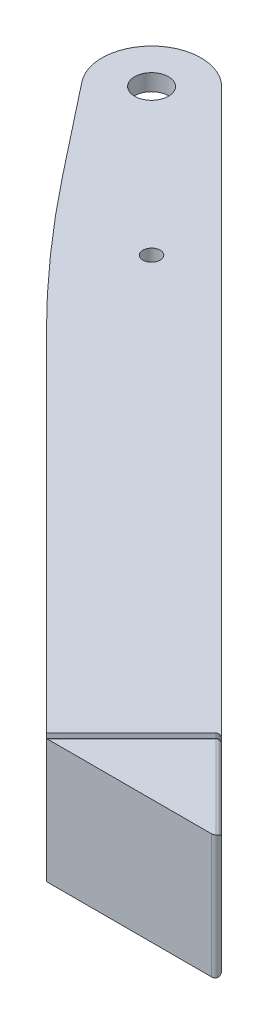
from build123d import *

# Parameters (mm, degrees)
SKETCH_2_R      = 4.1
SKETCH_2_R_2    = 2.1
EXTRUDE_1_DEPTH = 4
FILLET_1_R      = 400
EXTRUDE_4_DEPTH = 30
EXTRUDE_5_REACH = 231.249
SKETCH_8_W      = 30
SKETCH_8_H      = 13
FILLET_5_R      = 1


with BuildPart() as part:
    # 草图2 → 凸台-拉伸1 (new body)
    with BuildSketch(Plane(origin=(0, 0, 0), x_dir=(1, 0, 0), z_dir=(0, 1, 0))):
        with BuildLine():
            Line((136.929210249, -162.385054371), (179.35561712, -162.385054371))
            Line((179.35561712, -162.385054371), (8.485281374, 8.485281374))
            ThreePointArc((8.485281374, 8.485281374), (-7.971171133, 8.969973844), (-9.423568154, -7.429425499))
            Line((-9.423568154, -7.429425499), (22.627416998, -48.083261121))
            Line((22.627416998, -48.083261121), (136.929210249, -162.385054371))
        make_face()
        with Locations(Location((0, 0, 0), (0, 0, 270))):
            Circle(SKETCH_2_R, mode=Mode.SUBTRACT)
        with Locations(Location((35.355339059, -35.355339059, 0), (0, 0, 270))):
            Circle(SKETCH_2_R_2, mode=Mode.SUBTRACT)
    extrude(amount=EXTRUDE_1_DEPTH)

    # 圆角1
    fillet_1_edges = [part.edges().sort_by_distance(p)[0] for p in [
        (22.627416998, 2, 48.083261121),
    ]]
    fillet(fillet_1_edges, radius=FILLET_1_R)

    # 草图6 → 凸台-拉伸4 (add)
    with BuildSketch(Plane(origin=(-12.727922061, 0, 12.727922061), x_dir=(0.7071067811865476, 0, 0.7071067811865475), z_dir=(-0.7071067811865475, 0, 0.7071067811865476))):
        Polygon((191.647146219, 4), (191.647146219, 0), (211.647146219, -13), (211.647146219, 17), align=None)
    extrude(amount=-EXTRUDE_4_DEPTH)

    # 凸台-拉伸5: up to this face of the body (flat: up to its plane)
    extrude_5_end = Plane(part.part.faces().sort_by_distance((158.142413684, 2, 162.385054371))[0])
    # 草图8 → 凸台-拉伸5 (add, up to the picked face)
    with BuildSketch(Plane(origin=(149.65713231, 0, 149.65713231), x_dir=(0.7071067811865475, 0, -0.7071067811865476), z_dir=(0.7071067811865476, 0, 0.7071067811865475)), mode=Mode.PRIVATE) as extrude_5_sk1:
        with Locations((-3, 10.5)):
            Rectangle(SKETCH_8_W, SKETCH_8_H)
    extrude_5_tool1 = split(extrude(extrude_5_sk1.sketch, amount=EXTRUDE_5_REACH, mode=Mode.PRIVATE), bisect_by=extrude_5_end, keep=Keep.BOTH, mode=Mode.PRIVATE)
    # 草图8 → 凸台-拉伸5 (add, up to the picked face)
    with BuildSketch(Plane(origin=(149.65713231, 0, 149.65713231), x_dir=(0.7071067811865475, 0, -0.7071067811865476), z_dir=(0.7071067811865476, 0, 0.7071067811865475)), mode=Mode.PRIVATE) as extrude_5_sk2:
        with Locations((-3, -6.5)):
            Rectangle(SKETCH_8_W, SKETCH_8_H)
    extrude_5_tool2 = split(extrude(extrude_5_sk2.sketch, amount=EXTRUDE_5_REACH, mode=Mode.PRIVATE), bisect_by=extrude_5_end, keep=Keep.BOTH, mode=Mode.PRIVATE)
    add(extrude_5_tool1.solids().sort_by(Axis((147.535812, 10.5, 151.778453), (0.7071067811865476, 0, 0.7071067811865475)))[0])
    add(extrude_5_tool2.solids().sort_by(Axis((147.535812, -6.5, 151.778453), (0.7071067811865476, 0, 0.7071067811865475)))[0])

    # 圆角5
    fillet_5_edges = [part.edges().sort_by_distance(p)[0] for p in [
        (147.535811966, 17, 151.778452653),
        (151.071345872, -6.5, 134.100783124),
        (147.535811966, -13, 151.778452653),
        (151.071345872, 10.5, 134.100783124),
        (168.749015402, 17, 151.778452653),
        (168.749015402, -13, 151.778452653),
        (179.35561712, 2, 162.385054371),
    ]]
    fillet(fillet_5_edges, radius=FILLET_5_R)


solid = part.part
